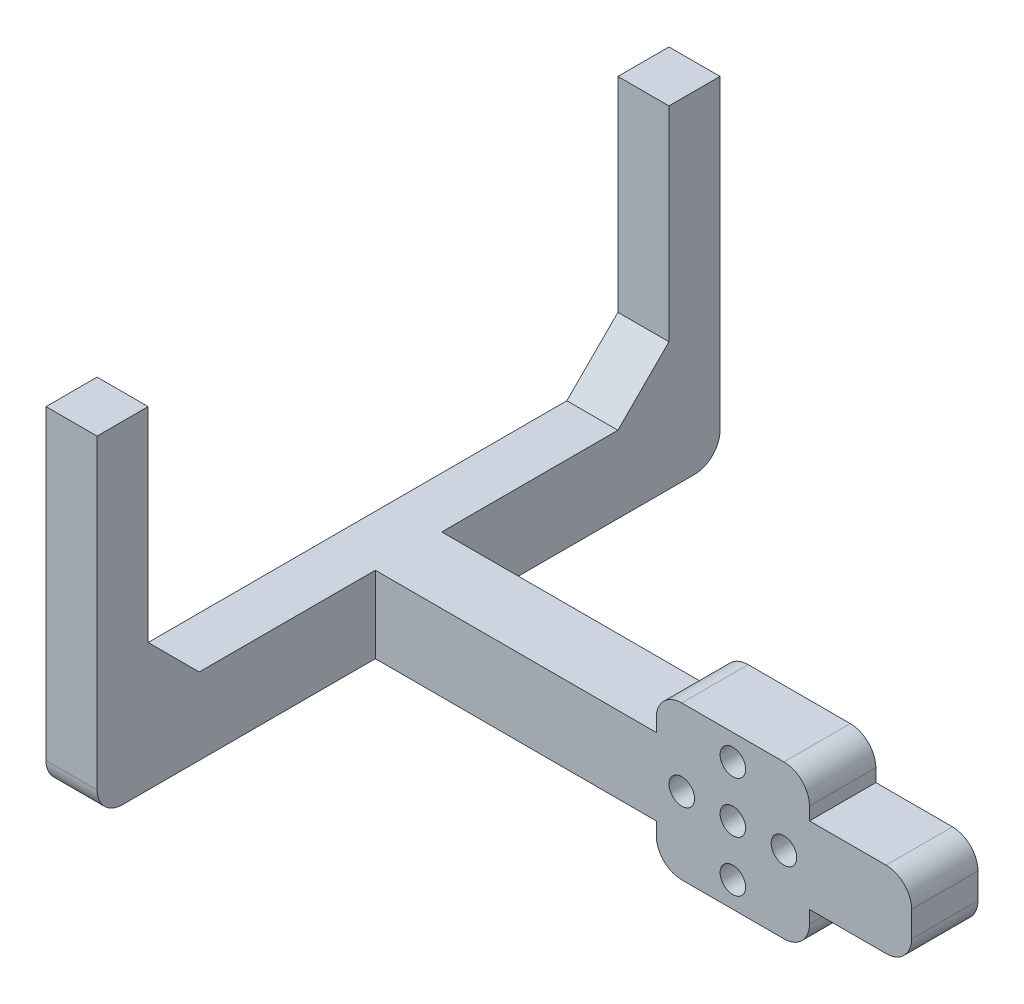
from build123d import *

# Parameters (mm, degrees)
SKETCH1_W            = 13
SKETCH1_H            = 15
BOSS_EXTRUDE1_DEPTH  = 150
SKETCH5_R            = 2.5
CUT_EXTRUDE3_DEPTH   = 151.748963512
SKETCH8_W            = 13
SKETCH8_H            = 15
BOSS_EXTRUDE3_DEPTH  = 15
SKETCH10_R           = 1.6
CUT_EXTRUDE4_DEPTH   = 151.888203648
SKETCH11_W           = 30
SKETCH11_H           = 30
BOSS_EXTRUDE4_DEPTH  = 13
SKETCH12_R           = 2.5
CUT_EXTRUDE5_DEPTH   = 152.307633647
FILLET1_R            = 5
FILLET2_R            = 5
SKETCH13_R           = 3
CUT_EXTRUDE6_DEPTH   = 152.81732444
SKETCH15_W           = 13
SKETCH15_H           = 15
BOSS_EXTRUDE5_DEPTH  = 40
SKETCH23_W           = 10
SKETCH23_H           = 15
BOSS_EXTRUDE10_DEPTH = 54.49
SKETCH24_W           = 10
SKETCH24_H           = 15
BOSS_EXTRUDE11_DEPTH = 54.49
SKETCH27_W           = 10
SKETCH27_H           = 10
BOSS_EXTRUDE13_DEPTH = 50
SKETCH28_W           = 90
SKETCH28_H           = 13
CUT_EXTRUDE15_DEPTH  = 175.48432623
CHAMFER1_SIZE        = 10
FILLET3_R            = 5


with BuildPart() as part:
    # Sketch1 → Boss-Extrude1 (new body)
    with BuildSketch(Plane(origin=(0, 0, 0), x_dir=(0, 0, -1), z_dir=(1, 0, 0))):
        Rectangle(SKETCH1_W, SKETCH1_H)
    extrude(amount=BOSS_EXTRUDE1_DEPTH)

    # Sketch5 → Cut-Extrude3 (cut, through all)
    with BuildSketch(Plane.XY.offset(6.5)):
        with Locations((115, 0)):
            Circle(SKETCH5_R)
        with Locations((125, 0)):
            Circle(SKETCH5_R)
        with Locations((105, 0)):
            Circle(SKETCH5_R)
    extrude(amount=-CUT_EXTRUDE3_DEPTH, mode=Mode.SUBTRACT)

    # Sketch8 → Boss-Extrude3 (add)
    with BuildSketch(Plane.ZY):
        Rectangle(SKETCH8_W, SKETCH8_H)
    extrude(amount=BOSS_EXTRUDE3_DEPTH)

    # Sketch10 → Cut-Extrude4 (cut, through all)
    with BuildSketch(Plane(origin=(0, -7.5, 0), x_dir=(-1, 0, 0), z_dir=(0, -1, 0))):
        with Locations(Location((7, 0, 0), (0, 0, 90))):
            Circle(SKETCH10_R)
        with Locations(Location((-12, 0, 0), (0, 0, 90))):
            Circle(SKETCH10_R)
    extrude(amount=-CUT_EXTRUDE4_DEPTH, mode=Mode.SUBTRACT)

    # Sketch11 → Boss-Extrude4 (add)
    with BuildSketch(Plane(origin=(0, 0, -6.5), x_dir=(-1, 0, 0), z_dir=(0, 0, -1))):
        with Locations((-115, 0)):
            Rectangle(SKETCH11_W, SKETCH11_H)
    extrude(amount=-BOSS_EXTRUDE4_DEPTH)

    # Sketch12 → Cut-Extrude5 (cut, through all)
    with BuildSketch(Plane(origin=(0, 0, -6.5), x_dir=(-1, 0, 0), z_dir=(0, 0, -1))):
        with Locations((-115, 10)):
            Circle(SKETCH12_R)
        with Locations((-105, 0)):
            Circle(SKETCH12_R)
        with Locations((-125, 0)):
            Circle(SKETCH12_R)
        with Locations((-115, 0)):
            Circle(SKETCH12_R)
        with Locations((-115, -10)):
            Circle(SKETCH12_R)
    extrude(amount=-CUT_EXTRUDE5_DEPTH, mode=Mode.SUBTRACT)

    # Fillet1
    fillet1_edges = [part.edges().sort_by_distance(p)[0] for p in [
        (100, 15, 0),
        (130, -15, 0),
        (100, -15, 0),
        (130, 15, 0),
    ]]
    fillet(fillet1_edges, radius=FILLET1_R)

    # Fillet2
    fillet2_edges = [part.edges().sort_by_distance(p)[0] for p in [
        (150, -7.5, 0),
        (150, 7.5, 0),
    ]]
    fillet(fillet2_edges, radius=FILLET2_R)

    # Sketch13 → Cut-Extrude6 (cut, through all)
    with BuildSketch(Plane(origin=(0, 7.5, 0), x_dir=(1, 0, 0), z_dir=(0, 1, 0))):
        with Locations(Location((2.5, 0, 0), (0, 0, 270))):
            Circle(SKETCH13_R)
    extrude(amount=-CUT_EXTRUDE6_DEPTH, mode=Mode.SUBTRACT)

    # Sketch15 → Boss-Extrude5 (add)
    with BuildSketch(Plane.ZY.offset(15)):
        Rectangle(SKETCH15_W, SKETCH15_H)
    extrude(amount=BOSS_EXTRUDE5_DEPTH)

    # Sketch23 → Boss-Extrude10 (add)
    with BuildSketch(Plane.XY.offset(6.5)):
        with Locations((40, 0)):
            Rectangle(SKETCH23_W, SKETCH23_H)
    extrude(amount=BOSS_EXTRUDE10_DEPTH)

    # Sketch24 → Boss-Extrude11 (add)
    with BuildSketch(Plane(origin=(0, 0, -6.5), x_dir=(-1, 0, 0), z_dir=(0, 0, -1))):
        with Locations((-40, 0)):
            Rectangle(SKETCH24_W, SKETCH24_H)
    extrude(amount=BOSS_EXTRUDE11_DEPTH)

    # Sketch27 → Boss-Extrude13 (add)
    with BuildSketch(Plane(origin=(0, 7.5, 0), x_dir=(1, 0, 0), z_dir=(0, 1, 0))):
        with Locations((40, 55.99)):
            Rectangle(SKETCH27_W, SKETCH27_H)
        with Locations((40, -55.99)):
            Rectangle(SKETCH27_W, SKETCH27_H)
    extrude(amount=BOSS_EXTRUDE13_DEPTH)

    # Sketch28 → Cut-Extrude15 (cut, through all)
    with BuildSketch(Plane.XZ.offset(7.5)):
        with Locations((-10, 0)):
            Rectangle(SKETCH28_W, SKETCH28_H)
    extrude(amount=-CUT_EXTRUDE15_DEPTH, mode=Mode.SUBTRACT)

    # Chamfer1
    chamfer1_edges = [part.edges().sort_by_distance(p)[0] for p in [
        (40, 7.5, -50.99),
        (40, 7.5, 50.99),
    ]]
    chamfer(chamfer1_edges, length=CHAMFER1_SIZE)

    # Fillet3
    fillet3_edges = [part.edges().sort_by_distance(p)[0] for p in [
        (40, -7.5, 60.99),
        (40, -7.5, -60.99),
    ]]
    fillet(fillet3_edges, radius=FILLET3_R)


solid = part.part
